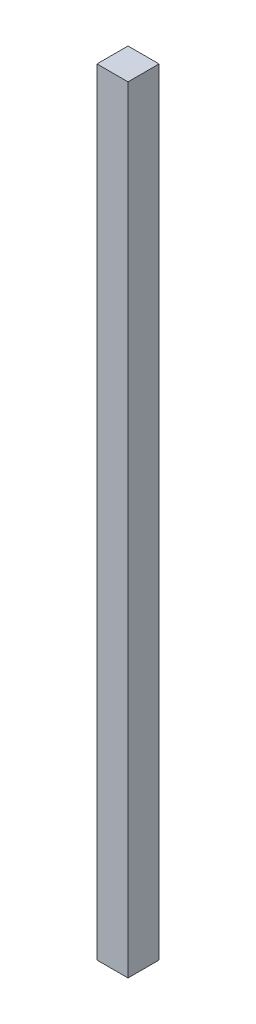
from build123d import *

# Parameters (mm, degrees)
SKETCH1_W           = 20
SKETCH1_H           = 20
BOSS_EXTRUDE1_DEPTH = 500


with BuildPart() as part:
    # Sketch1 → Boss-Extrude1 (new body)
    with BuildSketch(Plane(origin=(0, 0, 0), x_dir=(1, 0, 0), z_dir=(0, 1, 0))):
        Rectangle(SKETCH1_W, SKETCH1_H)
    extrude(amount=BOSS_EXTRUDE1_DEPTH)


solid = part.part
